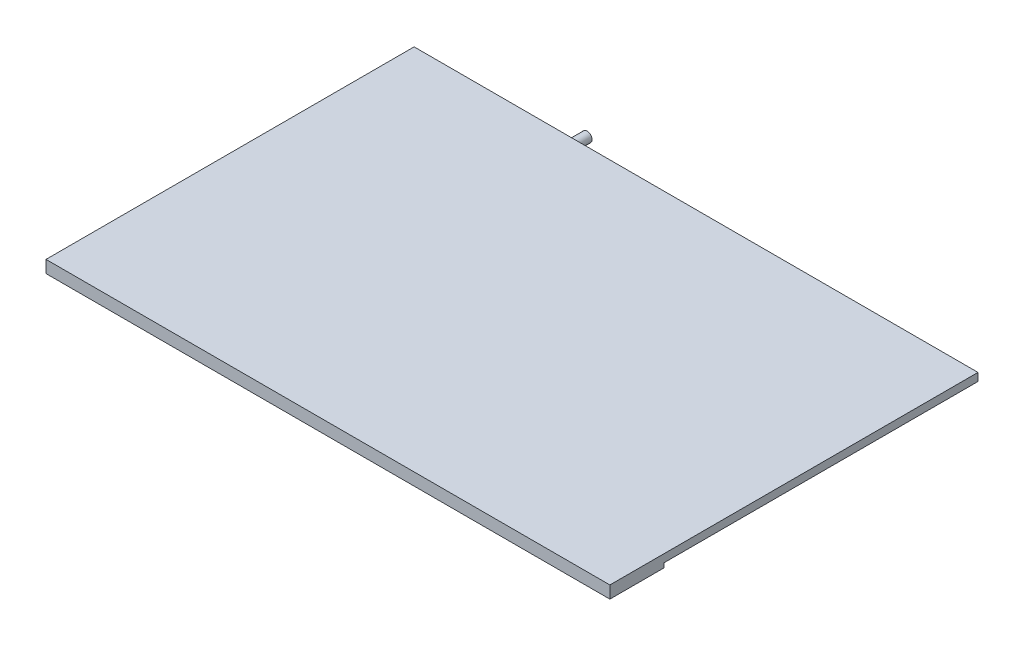
from build123d import *

# Parameters (mm, degrees)
SKETCH1_W           = 229
SKETCH1_H           = 149.5
BOSS_EXTRUDE1_DEPTH = 3.2
SKETCH2_W           = 229
SKETCH2_H           = 22
BOSS_EXTRUDE2_DEPTH = 5
SKETCH3_W           = 26.5
SKETCH3_H           = 8.8
SKETCH3_W_2         = 11
SKETCH3_H_2         = 114.3
BOSS_EXTRUDE3_DEPTH = 3
SKETCH4_R           = 2
BOSS_EXTRUDE4_DEPTH = 10


with BuildPart() as part:
    # Sketch1 → Boss-Extrude1 (new body)
    with BuildSketch(Plane(origin=(0, 0, 0), x_dir=(1, 0, 0), z_dir=(0, 1, 0))):
        Rectangle(SKETCH1_W, SKETCH1_H)
    extrude(amount=BOSS_EXTRUDE1_DEPTH)

    # Sketch2 → Boss-Extrude2 (add)
    with BuildSketch(Plane(origin=(0, 3.2, 0), x_dir=(1, 0, 0), z_dir=(0, 1, 0))):
        with Locations((0, -63.75)):
            Rectangle(SKETCH2_W, SKETCH2_H)
    extrude(amount=-BOSS_EXTRUDE2_DEPTH)

    # Sketch3 → Boss-Extrude3 (add)
    with BuildSketch(Plane.XZ.offset(1.8)):
        Polygon((-41, 52.75), (-67.5, 52.75), (-67.5, 39.55), (-59.75, 39.55), (-48.75, 39.55), (-41, 39.55), align=None)
        with Locations((-54.25, 57.15)):
            Rectangle(SKETCH3_W, SKETCH3_H)
        with Locations((-54.25, -17.6)):
            Rectangle(SKETCH3_W_2, SKETCH3_H_2)
    extrude(amount=BOSS_EXTRUDE3_DEPTH)

    # Sketch4 → Boss-Extrude4 (add)
    with BuildSketch(Plane(origin=(0, 0, -74.75), x_dir=(-1, 0, 0), z_dir=(0, 0, -1))):
        with Locations(Location((54.25, -3.3, 0), (0, 0, 131.409622109))):
            Circle(SKETCH4_R)
    extrude(amount=BOSS_EXTRUDE4_DEPTH)


solid = part.part
